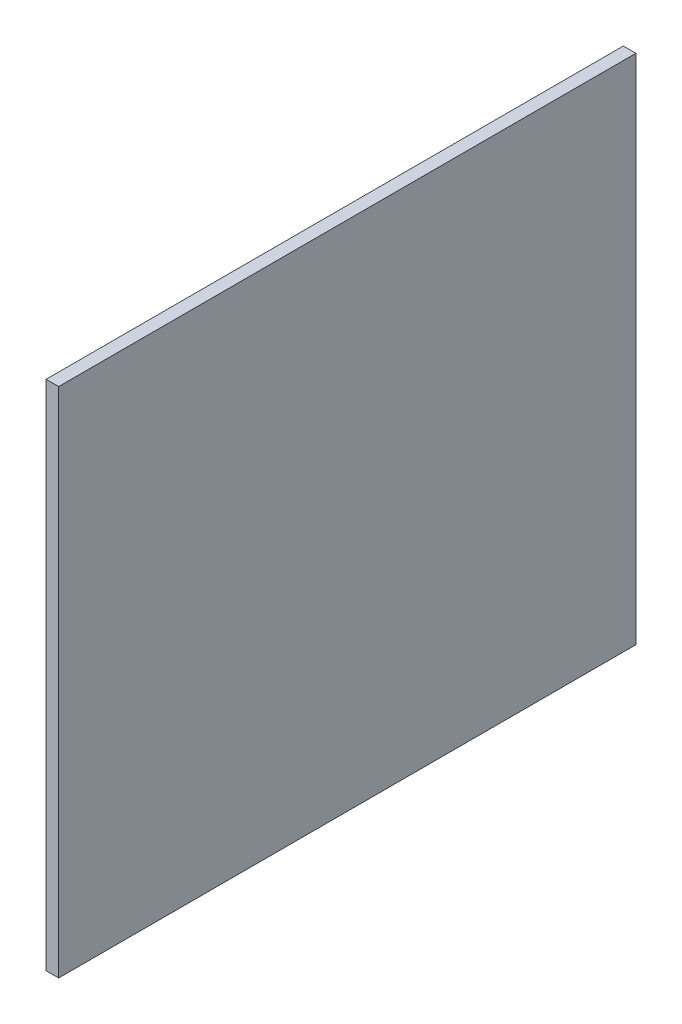
from build123d import *

# Parameters (mm, degrees)
SKETCH1_W           = 12
SKETCH1_H           = 488
BOSS_EXTRUDE1_DEPTH = 550


with BuildPart() as part:
    # Sketch1 → Boss-Extrude1 (new body)
    with BuildSketch(Plane.XY):
        with Locations((-84.461538462, -132.307692308)):
            Rectangle(SKETCH1_W, SKETCH1_H)
    extrude(amount=BOSS_EXTRUDE1_DEPTH)


solid = part.part
